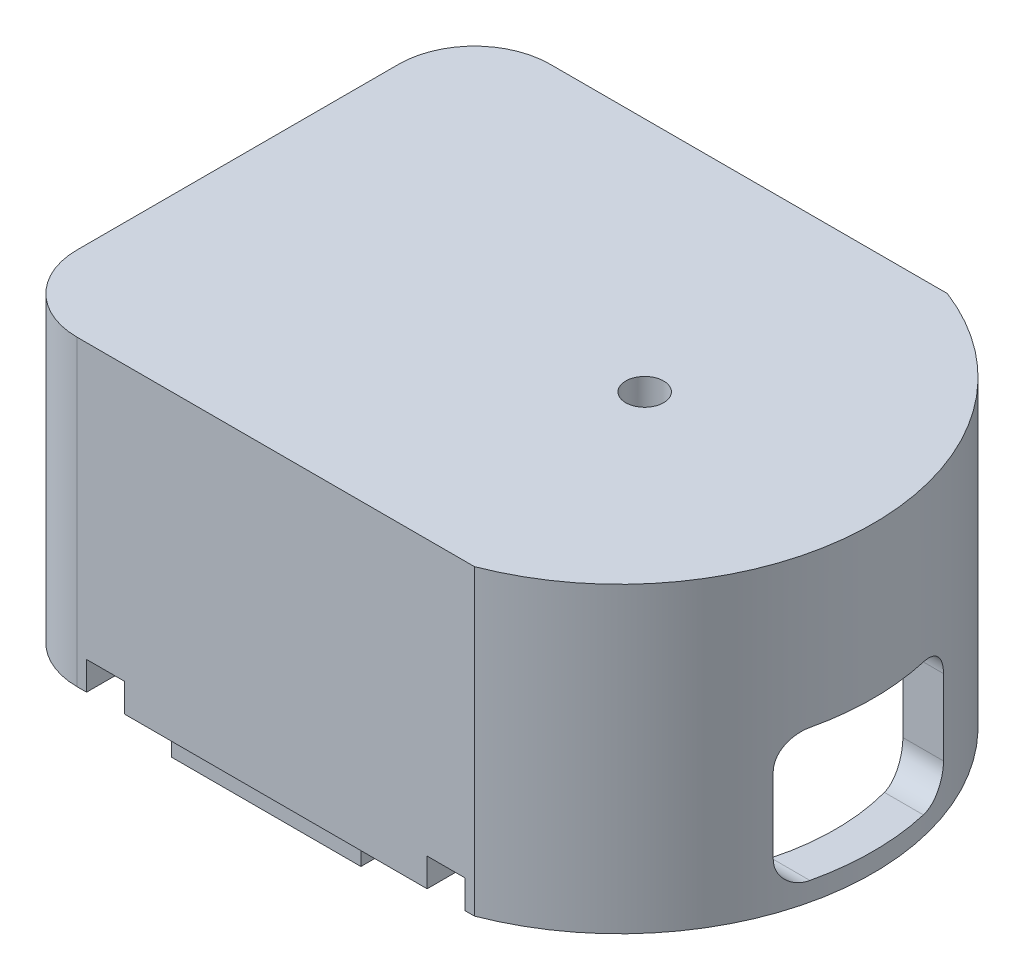
from build123d import *

# Parameters (mm, degrees)
Y_KSEKLIK_EKSTR_ZYON1_DEPTH = 160
KES_EKSTR_ZYON1_DEPTH       = 140
IZIM3_W                     = 10
IZIM3_H                     = 100
IZIM3_W_2                   = 100
IZIM3_H_2                   = 10
Y_KSEKLIK_EKSTR_ZYON2_DEPTH = 12.3
IZIM4_R                     = 10
KES_EKSTR_ZYON2_DEPTH       = 641.3
KES_EKSTR_ZYON3_DEPTH       = 641.3
IZIM7_W                     = 20
IZIM7_H                     = 15
KES_EKSTR_ZYON4_DEPTH       = 641.3


with BuildPart() as part:
    # Çizim1 → Yükseklik-Ekstrüzyon1 (new body)
    with BuildSketch(Plane(origin=(0, 0, 0), x_dir=(1, 0, 0), z_dir=(0, 1, 0))):
        with BuildLine():
            Line((-127.864290172, 125), (82.135709828, 125))
            ThreePointArc((82.135709828, 125), (167.864290172, 0), (82.135709828, -125))
            Line((82.135709828, -125), (-127.864290172, -125))
            ThreePointArc((-127.864290172, -125), (-156.14856142, -113.284271247), (-167.864290172, -85))
            Line((-167.864290172, -85), (-167.864290172, 85))
            ThreePointArc((-167.864290172, 85), (-156.14856142, 113.284271247), (-127.864290172, 125))
        make_face()
    extrude(amount=-Y_KSEKLIK_EKSTR_ZYON1_DEPTH)

    # Çizim2 → Kes-Ekstrüzyon1 (cut)
    with BuildSketch(Plane.XZ.offset(160)):
        with BuildLine():
            Line((-127.864290172, -105), (78.252278635, -105))
            ThreePointArc((78.252278635, -105), (147.864290172, 0), (78.252278635, 105))
            Line((78.252278635, 105), (-127.864290172, 105))
            ThreePointArc((-127.864290172, 105), (-142.006425796, 99.142135624), (-147.864290172, 85))
            Line((-147.864290172, 85), (-147.864290172, -85))
            ThreePointArc((-147.864290172, -85), (-142.006425796, -99.142135624), (-127.864290172, -105))
        make_face()
    extrude(amount=-KES_EKSTR_ZYON1_DEPTH, mode=Mode.SUBTRACT)

    # Çizim3 → Yükseklik-Ekstrüzyon2 (add)
    with BuildSketch(Plane(origin=(0, -160, 0), x_dir=(-1, 0, 0), z_dir=(0, -1, 0))):
        with Locations((157.864290172, 0)):
            Rectangle(IZIM3_W, IZIM3_H)
        with Locations((32.864290172, 115)):
            Rectangle(IZIM3_W_2, IZIM3_H_2)
        with Locations((32.864290172, -115)):
            Rectangle(IZIM3_W_2, IZIM3_H_2)
    extrude(amount=Y_KSEKLIK_EKSTR_ZYON2_DEPTH)

    # Çizim4 → Kes-Ekstrüzyon2 (cut)
    with BuildSketch(Plane(origin=(0, 0, 0), x_dir=(1, 0, 0), z_dir=(0, 1, 0))):
        with Locations(Location((47.135709828, 0, 0), (0, 0, 270))):
            Circle(IZIM4_R)
    extrude(amount=-KES_EKSTR_ZYON2_DEPTH, mode=Mode.SUBTRACT)

    # Çizim6 → Kes-Ekstrüzyon3 (cut)
    with BuildSketch(Plane.ZY.offset(-62.135709828)):
        with BuildLine():
            Line((-30, -80), (30, -80))
            ThreePointArc((30, -80), (40.606601718, -84.393398282), (45, -95))
            Line((45, -95), (45, -135))
            ThreePointArc((45, -135), (40.606601718, -145.606601718), (30, -150))
            Line((30, -150), (-30, -150))
            ThreePointArc((-30, -150), (-40.606601718, -145.606601718), (-45, -135))
            Line((-45, -135), (-45, -95))
            ThreePointArc((-45, -95), (-40.606601718, -84.393398282), (-30, -80))
        make_face()
    extrude(amount=-KES_EKSTR_ZYON3_DEPTH, mode=Mode.SUBTRACT)

    # Çizim7 → Kes-Ekstrüzyon4 (cut)
    with BuildSketch(Plane.XY.offset(125)):
        with Locations((-112.864290172, -152.5)):
            Rectangle(IZIM7_W, IZIM7_H)
        with Locations((67.135709828, -152.5)):
            Rectangle(IZIM7_W, IZIM7_H)
    extrude(amount=-KES_EKSTR_ZYON4_DEPTH, mode=Mode.SUBTRACT)


solid = part.part
